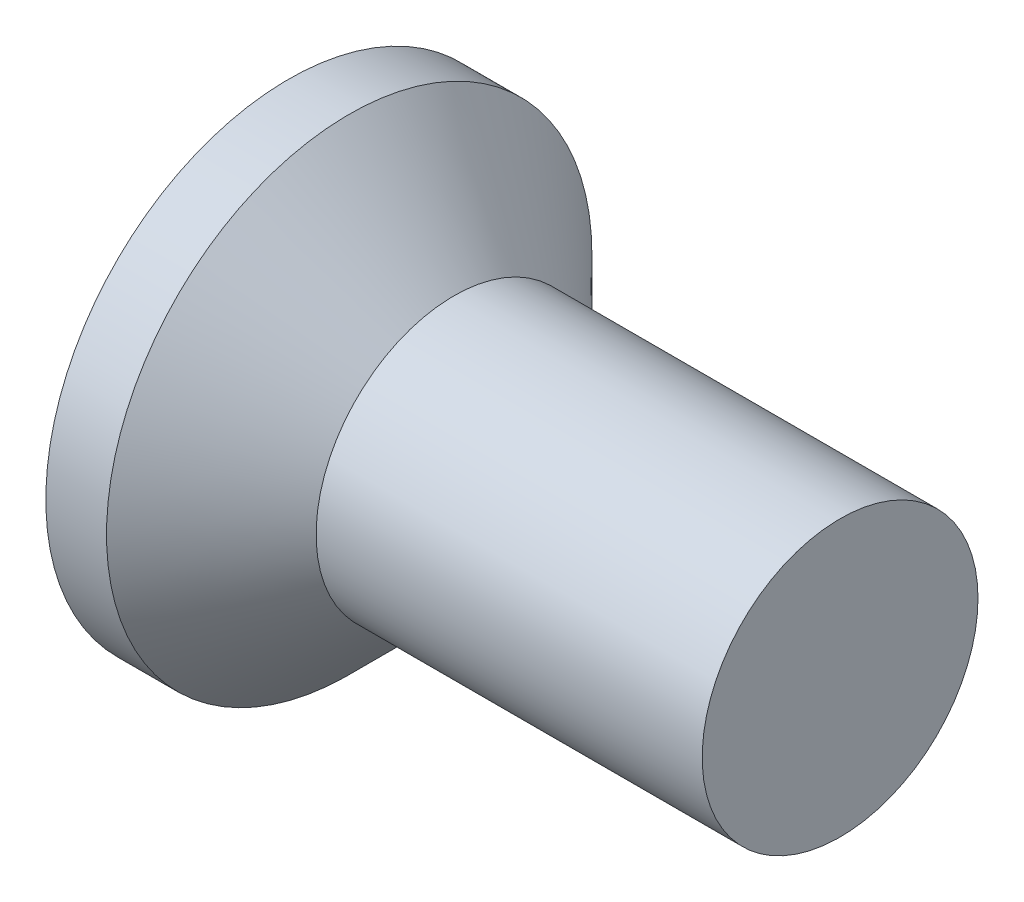
from build123d import *

# Parameters (mm, degrees)
CROSSRECESS_DEPTH = 0.75
DRAFT9_ANGLE      = 30
FILLET5_R         = 0.3
SKETCH10_W        = 0.45
SKETCH10_H        = 1.25


with BuildPart() as part:
    # Sketch1 → Base (revolve)
    with BuildSketch(Plane.XY, mode=Mode.PRIVATE) as base_sk:
        Polygon((5, 1.25), (2.4, 1.25), (1.5, 1.25), (0.55, 2.2), (0, 2.2), (0, 0), (5, 0), align=None)
    revolve(base_sk.sketch.rotate(Axis((4.515812911, 0, 0), (-1, 0, 0)), 90), axis=Axis((4.515812911, 0, 0), (-1, 0, 0)))

    # Sketch6 → CrossRecess (cut)
    with BuildSketch(Plane(origin=(0, 0, 0), x_dir=(0, 0, -1), z_dir=(1, 0, 0))):
        Polygon((0.29, 0.29), (0.29, 1.45), (-0.29, 1.45), (-0.29, 0.29), (-1.45, 0.29), (-1.45, -0.29), (-0.29, -0.29), (-0.29, -1.45), (0.29, -1.45), (0.29, -0.29), (1.45, -0.29), (1.45, 0.29), align=None)
    extrude(amount=CROSSRECESS_DEPTH, mode=Mode.SUBTRACT)

    # Draft9
    draft9_faces = [part.faces().sort_by_distance(p)[0] for p in [
        (0.375, -1.45, 0),
        (0.375, 0, 1.45),
        (0.375, 0, -1.45),
        (0.375, 1.45, 0),
    ]]
    draft(draft9_faces, Plane(origin=(0, 2.2, 0), x_dir=(0, 0, -1), z_dir=(-1, 0, 0)), DRAFT9_ANGLE)

    # Fillet5
    fillet5_edges = [part.edges().sort_by_distance(p)[0] for p in [
        (0.375, 0.29, 0.29),
        (0.375, -0.29, 0.29),
        (0.375, -0.29, -0.29),
        (0.375, 0.29, -0.29),
    ]]
    fillet(fillet5_edges, radius=FILLET5_R)

    # Sketch10 → Revolve2 (revolve)
    with BuildSketch(Plane.XY):
        with Locations((1.725, 0.625)):
            Rectangle(SKETCH10_W, SKETCH10_H)
    revolve(axis=Axis((62.228915663, 0, 0), (-1, 0, 0)))


solid = part.part
